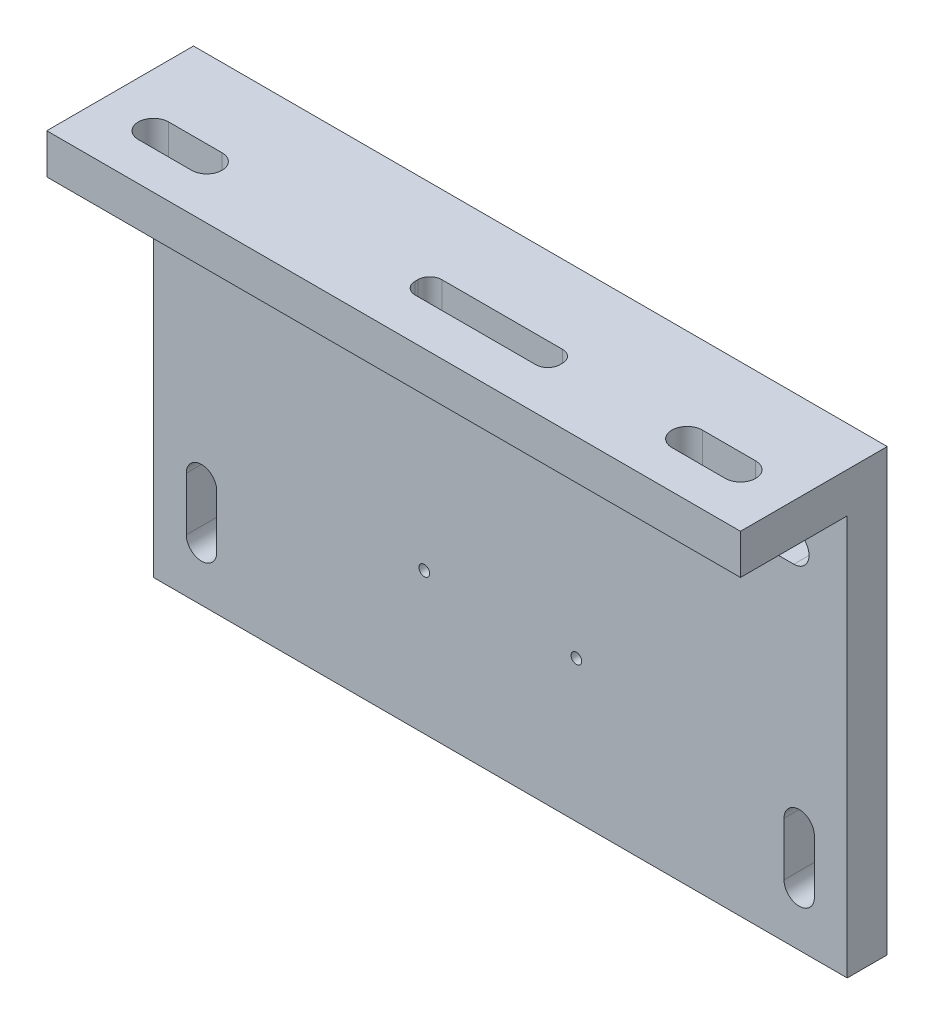
from build123d import *

# Parameters (mm, degrees)
SKETCH4_W          = 15
SKETCH4_H          = 150
MIDDLE_DEPTH       = 130
SKETCH10_R         = 2
MIDDLE_HOLES_DEPTH = 215.534379529
SKETCH11_W         = 55
SKETCH11_H         = 15
UPPER_DEPTH        = 130
UPPER_START        = 185
UPPER_HOLES_DEPTH  = 15
CUT_EXTRUDE1_DEPTH = 277.631523872


with BuildPart() as part:
    # Sketch4 → Middle (new, symmetric)
    with BuildSketch(Plane(origin=(0, 0, 0), x_dir=(0, 0, -1), z_dir=(1, 0, 0))):
        with Locations((172.5, 95)):
            Rectangle(SKETCH4_W, SKETCH4_H)
    extrude(amount=MIDDLE_DEPTH, both=True)

    # Sketch10 → Middle Holes (cut, through all)
    with BuildSketch(Plane(origin=(0, 0, -180), x_dir=(-1, 0, 0), z_dir=(0, 0, -1))):
        with Locations((-28.5, 150)):
            Circle(SKETCH10_R)
        with Locations((28.5, 150)):
            Circle(SKETCH10_R)
        with Locations((28.5, 73)):
            Circle(SKETCH10_R)
        with Locations((-28.5, 73)):
            Circle(SKETCH10_R)
        with BuildLine():
            Line((-110, 155.7), (-90, 155.7))
            ThreePointArc((-90, 155.7), (-84.3, 150), (-90, 144.3))
            Line((-90, 144.3), (-110, 144.3))
            ThreePointArc((-110, 144.3), (-115.7, 150), (-110, 155.7))
        make_face()
        with BuildLine():
            Line((90, 144.3), (110, 144.3))
            ThreePointArc((110, 144.3), (115.7, 150), (110, 155.7))
            Line((110, 155.7), (90, 155.7))
            ThreePointArc((90, 155.7), (84.3, 150), (90, 144.3))
        make_face()
        with BuildLine():
            Line((-117.7, 60), (-117.7, 40))
            ThreePointArc((-117.7, 40), (-112, 34.3), (-106.3, 40))
            Line((-106.3, 40), (-106.3, 60))
            ThreePointArc((-106.3, 60), (-112, 65.7), (-117.7, 60))
        make_face()
        with BuildLine():
            Line((106.3, 40), (106.3, 60))
            ThreePointArc((106.3, 60), (112, 65.7), (117.7, 60))
            Line((117.7, 60), (117.7, 40))
            ThreePointArc((117.7, 40), (112, 34.3), (106.3, 40))
        make_face()
    extrude(amount=-MIDDLE_HOLES_DEPTH, mode=Mode.SUBTRACT)

    # Sketch11 → Upper (add, symmetric)
    with BuildSketch(Plane(origin=(0, 0, 0), x_dir=(0, 0, -1), z_dir=(1, 0, 0))):
        with Locations((152.5, 177.5)):
            Rectangle(SKETCH11_W, SKETCH11_H)
    extrude(amount=UPPER_DEPTH, both=True)

    # Sketch12 → Upper Holes (cut)
    with BuildSketch(Plane(origin=(0, 0, 0), x_dir=(1, 0, 0), z_dir=(0, 1, 0)).offset(UPPER_START)):
        with BuildLine():
            Line((-110, 139.3), (-90, 139.3))
            ThreePointArc((-90, 139.3), (-84.3, 145), (-90, 150.7))
            Line((-90, 150.7), (-110, 150.7))
            ThreePointArc((-110, 150.7), (-115.7, 145), (-110, 139.3))
        make_face()
        with BuildLine():
            Line((110, 139.3), (90, 139.3))
            ThreePointArc((90, 139.3), (84.3, 145), (90, 150.7))
            Line((90, 150.7), (110, 150.7))
            ThreePointArc((110, 150.7), (115.7, 145), (110, 139.3))
        make_face()
    extrude(amount=-UPPER_HOLES_DEPTH, mode=Mode.SUBTRACT)

    # Sketch14 → Cut-Extrude1 (cut, through all)
    with BuildSketch(Plane(origin=(0, 185, 0), x_dir=(1, 0, 0), z_dir=(0, 1, 0))):
        with BuildLine():
            Line((42.098030274, 145.2), (42.098030274, 146.2))
            ThreePointArc((42.098030274, 146.2), (40.78001079, 149.381980515), (37.598030274, 150.7))
            Line((37.598030274, 150.7), (-7.634483759, 150.7))
            ThreePointArc((-7.634483759, 150.7), (-10.816464274, 149.381980515), (-12.134483759, 146.2))
            Line((-12.134483759, 146.2), (-12.134483759, 145.2))
            ThreePointArc((-12.134483759, 145.2), (-10.816464274, 142.018019485), (-7.634483759, 140.7))
            Line((-7.634483759, 140.7), (37.598030274, 140.7))
            ThreePointArc((37.598030274, 140.7), (40.78001079, 142.018019485), (42.098030274, 145.2))
        make_face()
    extrude(amount=-CUT_EXTRUDE1_DEPTH, mode=Mode.SUBTRACT)


solid = part.part
